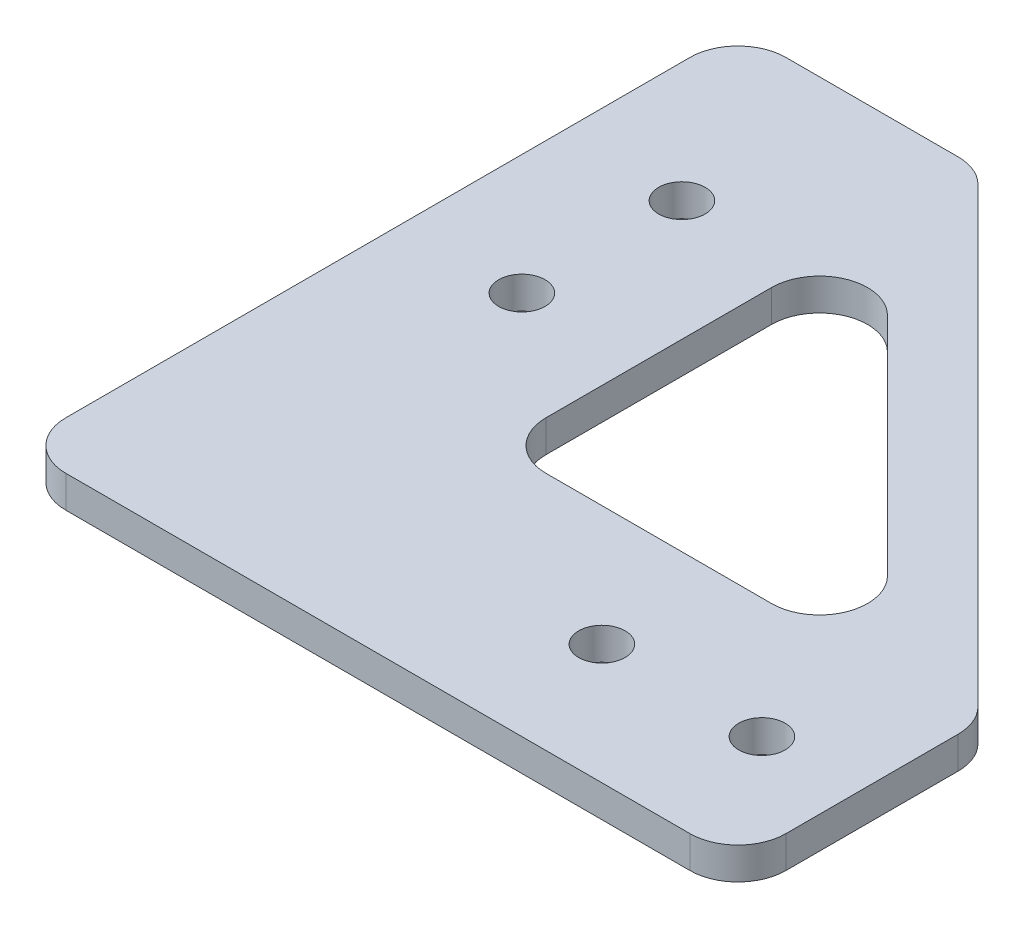
from build123d import *

# Parameters (mm, degrees)
SKETCH_1_R      = 1.45
EXTRUDE_1_DEPTH = 2
FILLET_1_R      = 3


with BuildPart() as part:
    # 草图1 → 凸台-拉伸1 (new body)
    with BuildSketch(Plane(origin=(0, 0, 0), x_dir=(1, 0, 0), z_dir=(0, 1, 0))):
        Polygon((45, 15), (15, 45), (0, 45), (0, 15), (0, 0), (15, 0), (45, 0), align=None)
        with Locations(Location((29, 7.5, 0), (0, 0, 270))):
            Circle(SKETCH_1_R, mode=Mode.SUBTRACT)
        with Locations(Location((39, 7.5, 0), (0, 0, 270))):
            Circle(SKETCH_1_R, mode=Mode.SUBTRACT)
        with Locations(Location((7.5, 24, 0), (0, 0, 270))):
            Circle(SKETCH_1_R, mode=Mode.SUBTRACT)
        with Locations(Location((7.5, 34, 0), (0, 0, 270))):
            Circle(SKETCH_1_R, mode=Mode.SUBTRACT)
        Polygon((15, 15), (15, 39.343145751), (39.343145751, 15), align=None, mode=Mode.SUBTRACT)
    extrude(amount=EXTRUDE_1_DEPTH)

    # 圆角1
    fillet_1_edges = [part.edges().sort_by_distance(p)[0] for p in [
        (15, 1, -45),
        (45, 1, -15),
        (45, 1, 0),
        (0, 1, 0),
        (0, 1, -45),
        (15, 1, -39.343145751),
        (15, 1, -15),
        (39.343145751, 1, -15),
    ]]
    fillet(fillet_1_edges, radius=FILLET_1_R)


solid = part.part
